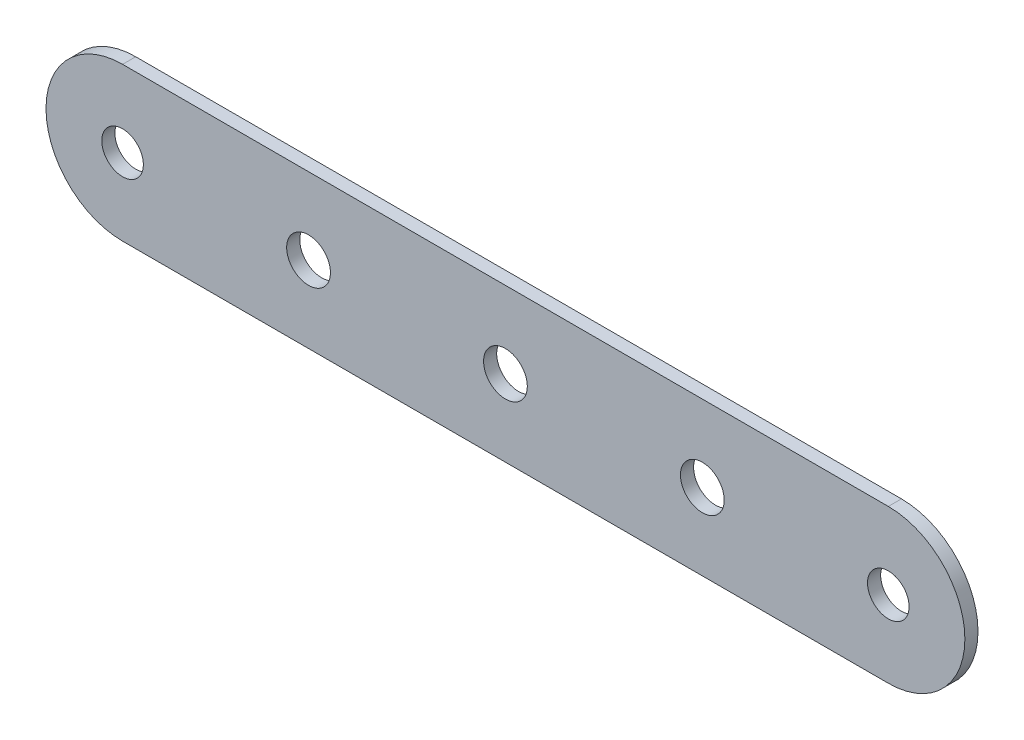
from build123d import *

# Parameters (mm, degrees)
SKETCH1_R           = 9.5
SKETCH1_R_2         = 10
BOSS_EXTRUDE1_DEPTH = 6


with BuildPart() as part:
    # Sketch1 → Boss-Extrude1 (new body)
    with BuildSketch(Plane.XY):
        with BuildLine():
            Line((-35.529687849, 37.131147541), (314.470312151, 37.131147541))
            ThreePointArc((314.470312151, 37.131147541), (349.470312151, 2.131147541), (314.470312151, -32.868852459))
            Line((314.470312151, -32.868852459), (-35.529687849, -32.868852459))
            ThreePointArc((-35.529687849, -32.868852459), (-70.529687849, 2.131147541), (-35.529687849, 37.131147541))
        make_face()
        with Locations((-35.529687849, 2.131147541)):
            Circle(SKETCH1_R, mode=Mode.SUBTRACT)
        with Locations((314.470312151, 2.131147541)):
            Circle(SKETCH1_R, mode=Mode.SUBTRACT)
        with Locations((139.470312151, 2.131147541)):
            Circle(SKETCH1_R_2, mode=Mode.SUBTRACT)
        with Locations((229.470312151, 2.131147541)):
            Circle(SKETCH1_R_2, mode=Mode.SUBTRACT)
        with Locations((49.470312151, 2.131147541)):
            Circle(SKETCH1_R_2, mode=Mode.SUBTRACT)
    extrude(amount=BOSS_EXTRUDE1_DEPTH)


solid = part.part
